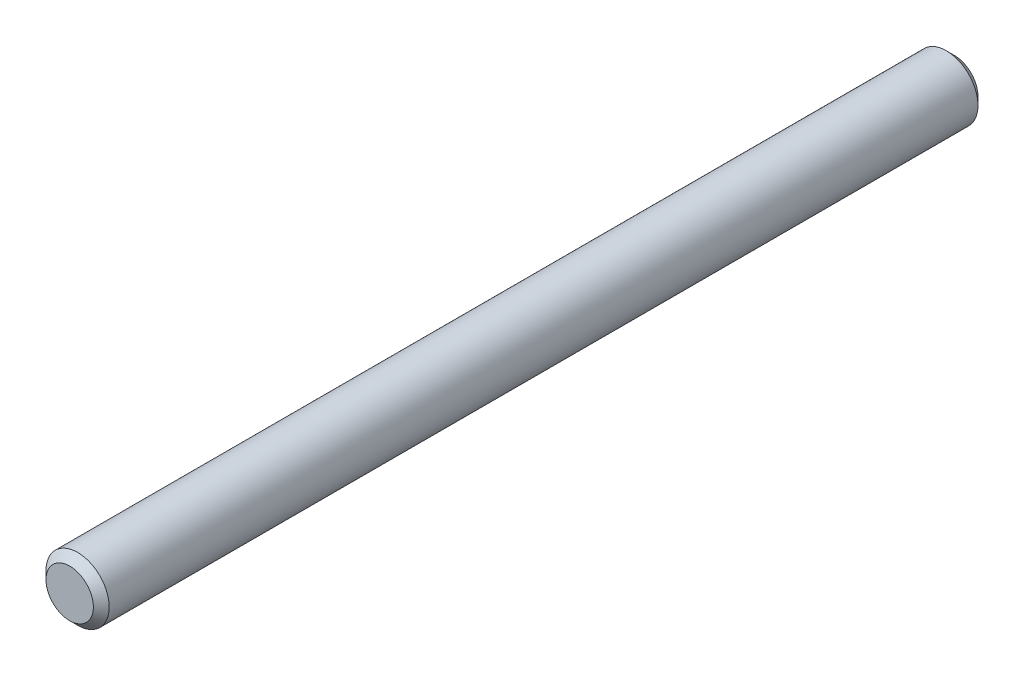
from build123d import *


with BuildPart() as part:
    # Esquisse1 → Révolution1 (revolve)
    with BuildSketch(Plane.XZ, mode=Mode.PRIVATE) as r_volution1_sk:
        Polygon((0.75, 14), (0, 14), (0, -14), (0.75, -14), (1, -13.75), (1, 13.75), align=None)
    revolve(r_volution1_sk.sketch.rotate(Axis((0, 0, 14), (0, 0, -1)), 180), axis=Axis((0, 0, 14), (0, 0, -1)))


solid = part.part
